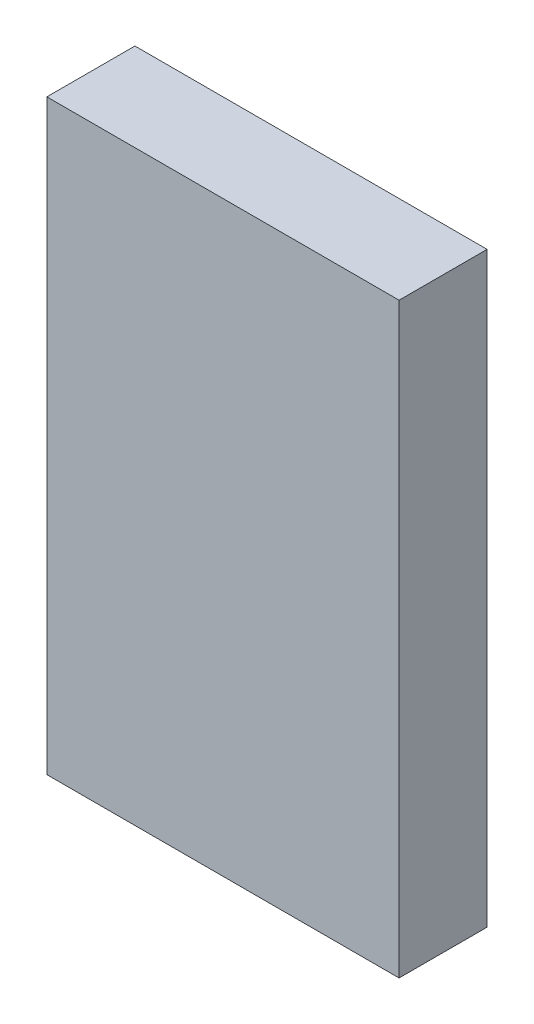
from build123d import *

# Parameters (mm, degrees)
SKETCH1_W           = 19.05
SKETCH1_H           = 31.75
BOSS_EXTRUDE1_DEPTH = 4.7625


with BuildPart() as part:
    # Sketch1 → Boss-Extrude1 (new body)
    with BuildSketch(Plane.XY):
        with Locations((9.525, 15.875)):
            Rectangle(SKETCH1_W, SKETCH1_H)
    extrude(amount=BOSS_EXTRUDE1_DEPTH)


solid = part.part
